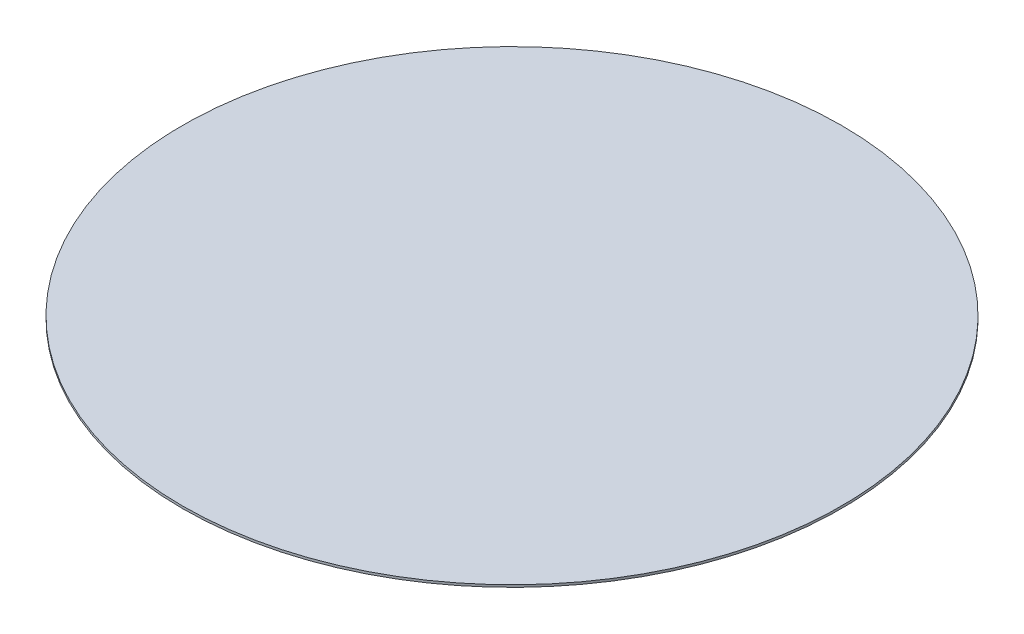
from build123d import *

# Parameters (mm, degrees)
SKETCH1_R           = 100
BOSS_EXTRUDE1_DEPTH = 0.7


with BuildPart() as part:
    # Sketch1 → Boss-Extrude1 (new body)
    with BuildSketch(Plane(origin=(0, 0, 0), x_dir=(1, 0, 0), z_dir=(0, 1, 0))):
        with Locations(Location((0, 0, 0), (0, 0, 270))):
            Circle(SKETCH1_R)
    extrude(amount=BOSS_EXTRUDE1_DEPTH)


solid = part.part
